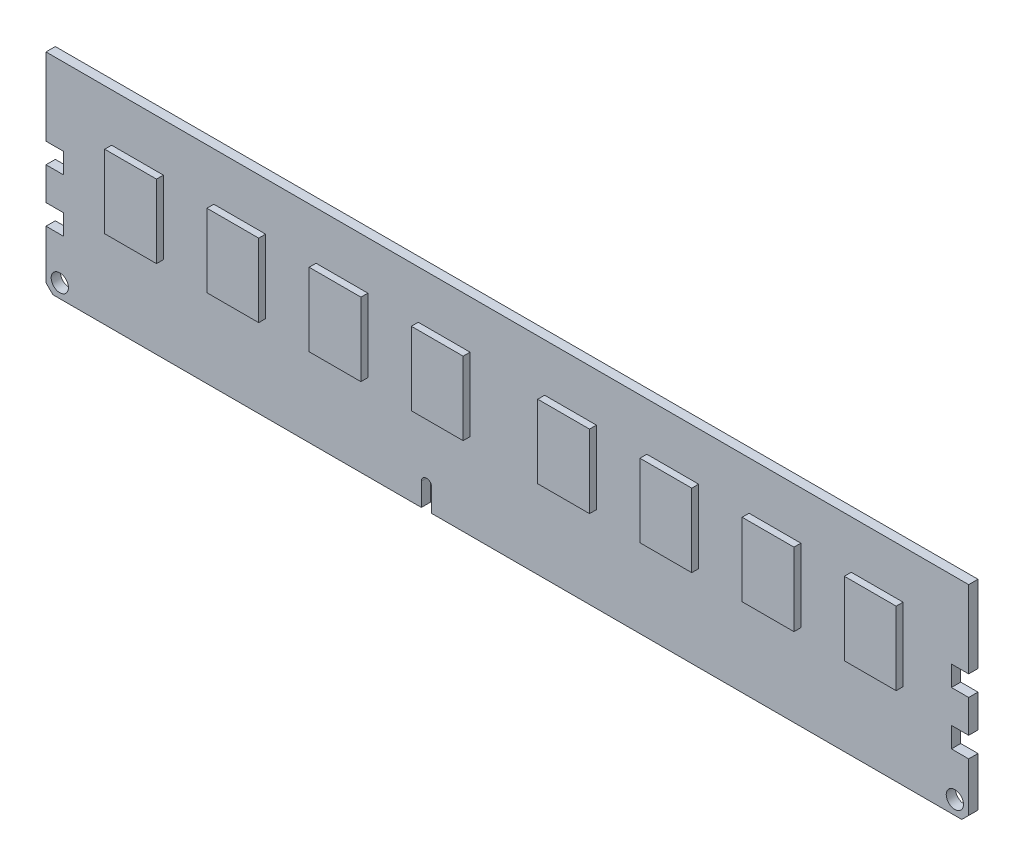
from build123d import *

# Parameters (mm, degrees)
SKETCH1_R           = 1.25
BOSS_EXTRUDE1_DEPTH = 0.675
SKETCH2_W           = 7.5
SKETCH2_H           = 10.6
BOSS_EXTRUDE2_DEPTH = 1
CUT_EXTRUDE1_DEPTH  = 74.244556112


with BuildPart() as part:
    # Sketch1 → Boss-Extrude1 (new body)
    with BuildSketch(Plane.XY):
        Polygon((-66.8, 18.75), (-64.3, 18.75), (-64.3, 15.8), (-66.8, 15.8), (-66.8, 11.05), (-64.3, 11.05), (-64.3, 8.1), (-66.8, 8.1), (-66.8, 1), (-65.8, 0), (0, 0), (0, 29.95), (-66.8, 29.95), align=None)
        with Locations(Location((-64.8, 2, 0), (0, 0, 180))):
            Circle(SKETCH1_R, mode=Mode.SUBTRACT)
    extrude(amount=BOSS_EXTRUDE1_DEPTH)

    # Sketch2 → Boss-Extrude2 (add)
    with BuildSketch(Plane.XY.offset(0.675)):
        with Locations((-53.55, 17.7)):
            Rectangle(SKETCH2_W, SKETCH2_H)
        with Locations((-38.75, 17.7)):
            Rectangle(SKETCH2_W, SKETCH2_H)
        with Locations((-23.95, 17.7)):
            Rectangle(SKETCH2_W, SKETCH2_H)
        with Locations((-9.15, 17.7)):
            Rectangle(SKETCH2_W, SKETCH2_H)
    extrude(amount=BOSS_EXTRUDE2_DEPTH)

    # Mirror1: part across plane


with BuildPart() as part_1:
    add(part.part)
    add(part.part.mirror(Plane.XY))

    # Mirror2: part across plane


with BuildPart() as part_2:
    add(part_1.part)
    add(part_1.part.mirror(Plane(origin=(0, 0, 0), x_dir=(0, 0, 1), z_dir=(1, 0, 0))))

    # Sketch3 → Cut-Extrude1 (cut, through all)
    with BuildSketch(Plane.XY.offset(0.675)):
        with BuildLine():
            Line((-12.45, 0), (-12.45, 3.3))
            ThreePointArc((-12.45, 3.3), (-11.7, 4.05), (-10.95, 3.3))
            Line((-10.95, 3.3), (-10.95, 0))
            Line((-10.95, 0), (-12.45, 0))
        make_face()
    extrude(amount=-CUT_EXTRUDE1_DEPTH, mode=Mode.SUBTRACT)


solid = part_2.part
